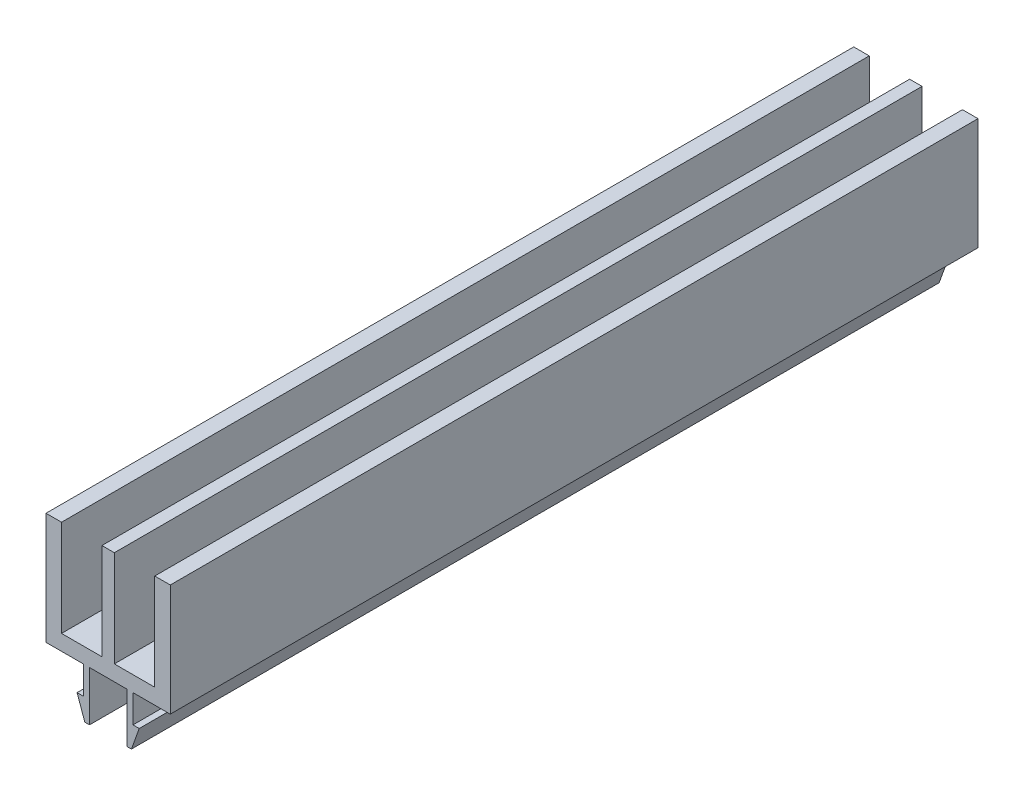
from build123d import *

# Parameters (mm, degrees)
BOSS_EXTRU_1_DEPTH = 130


with BuildPart() as part:
    # Esquisse1 → Boss.-Extru.1 (new body)
    with BuildSketch(Plane.XY.offset(50)):
        Polygon((-1, 2.5), (-7.5, 2.5), (-7.5, 17.999999998), (-10, 17.999999998), (-10, 0), (-4, 0), (-4, -4.5), (-5, -4.5), (-3.75, -8), (-3, -8), (-3, 0), (3, 0), (3, -8), (3.75, -8), (5, -4.5), (4, -4.5), (4, 0), (10, 0), (10, 17.999999998), (7.5, 17.999999998), (7.5, 2.5), (1, 2.5), (1, 17.999999998), (-1, 17.999999998), align=None)
    extrude(amount=-BOSS_EXTRU_1_DEPTH)


solid = part.part
